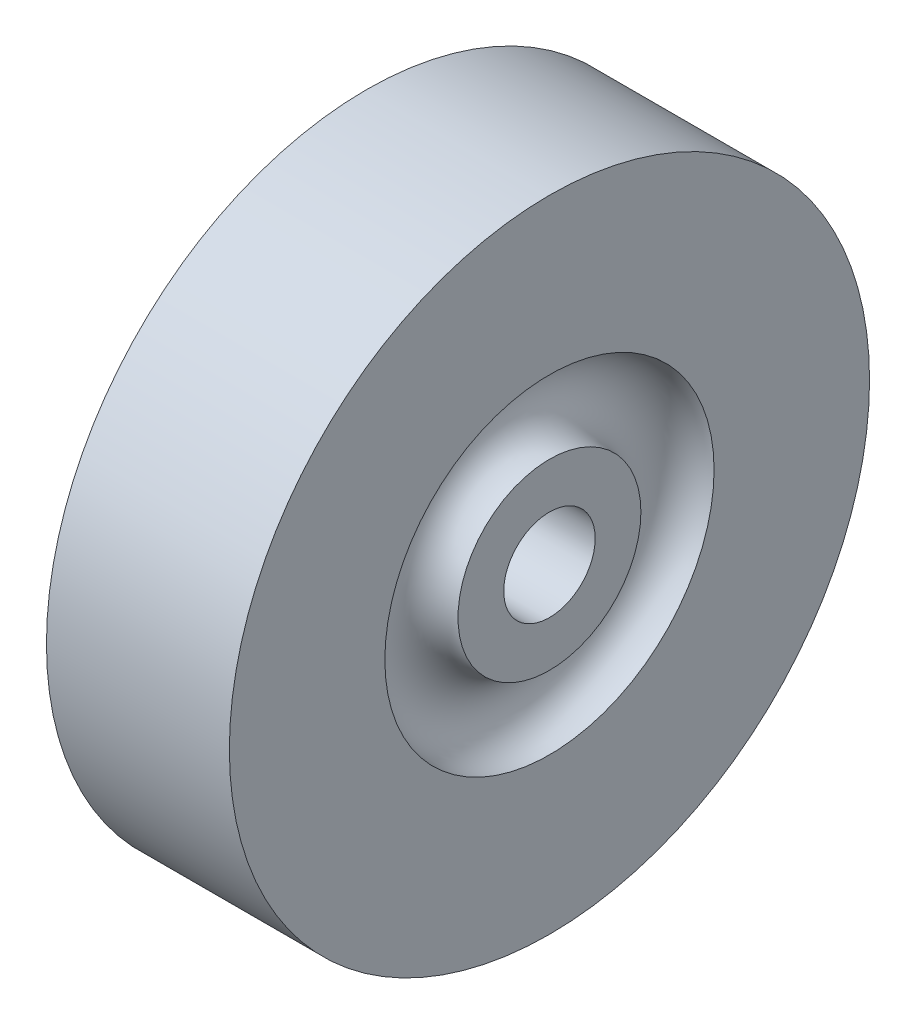
from build123d import *


with BuildPart() as part:
    # Sketch1 → Revolve1 (revolve)
    with BuildSketch(Plane.XY, mode=Mode.PRIVATE) as revolve1_sk:
        with BuildLine():
            Line((12.7, 22.86), (12.7, 44.45))
            Line((12.7, 44.45), (-12.7, 44.45))
            Line((-12.7, 44.45), (-12.7, 22.86))
            ThreePointArc((-12.7, 22.86), (-7.62, 17.78), (-12.7, 12.7))
            Line((-12.7, 12.7), (-12.7, 6.35))
            Line((-12.7, 6.35), (12.7, 6.35))
            Line((12.7, 6.35), (12.7, 12.7))
            ThreePointArc((12.7, 12.7), (7.62, 17.78), (12.7, 22.86))
        make_face()
    revolve(revolve1_sk.sketch.rotate(Axis((12.7, 0, 0), (-1, 0, 0)), 90), axis=Axis((12.7, 0, 0), (-1, 0, 0)))


solid = part.part
